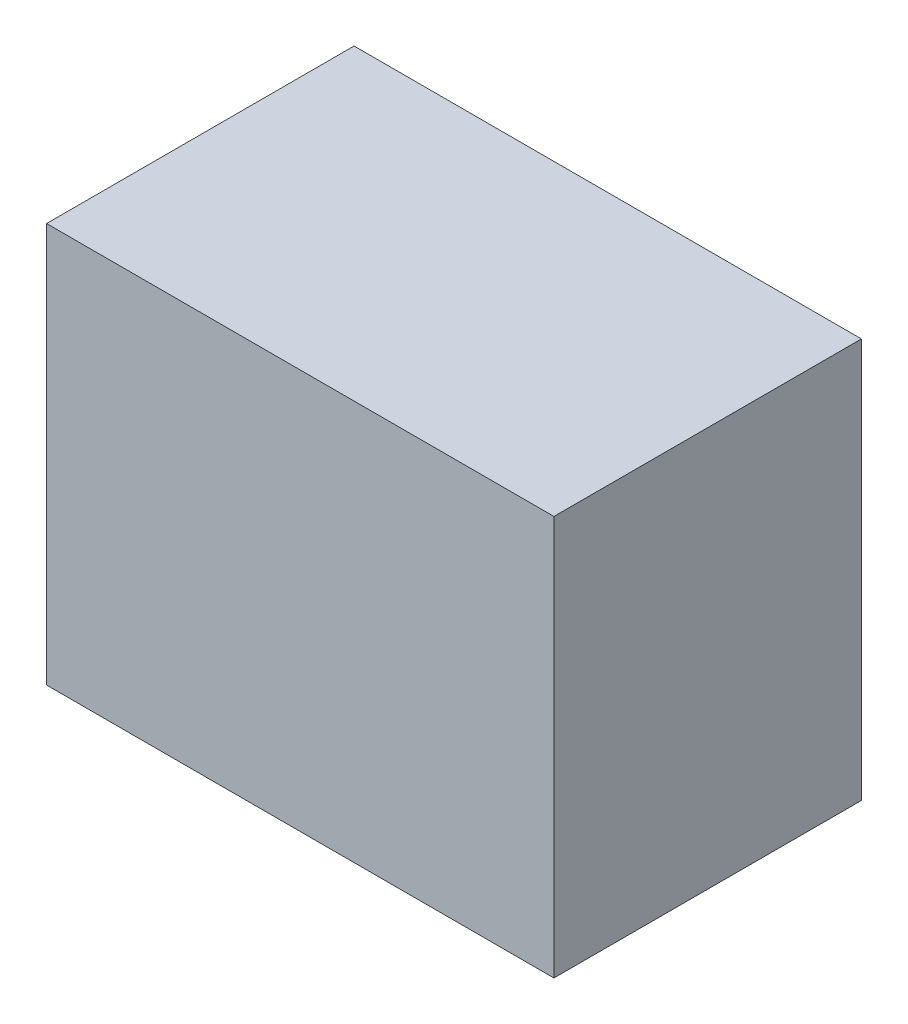
from build123d import *

# Parameters (mm, degrees)
SKETCH_1_W      = 16.5
SKETCH_1_H      = 13
EXTRUDE_1_DEPTH = 10


with BuildPart() as part:
    # Эскиз1 → Бобышка-Вытянуть1 (new body)
    with BuildSketch(Plane.XY):
        Rectangle(SKETCH_1_W, SKETCH_1_H)
    extrude(amount=EXTRUDE_1_DEPTH)


solid = part.part
